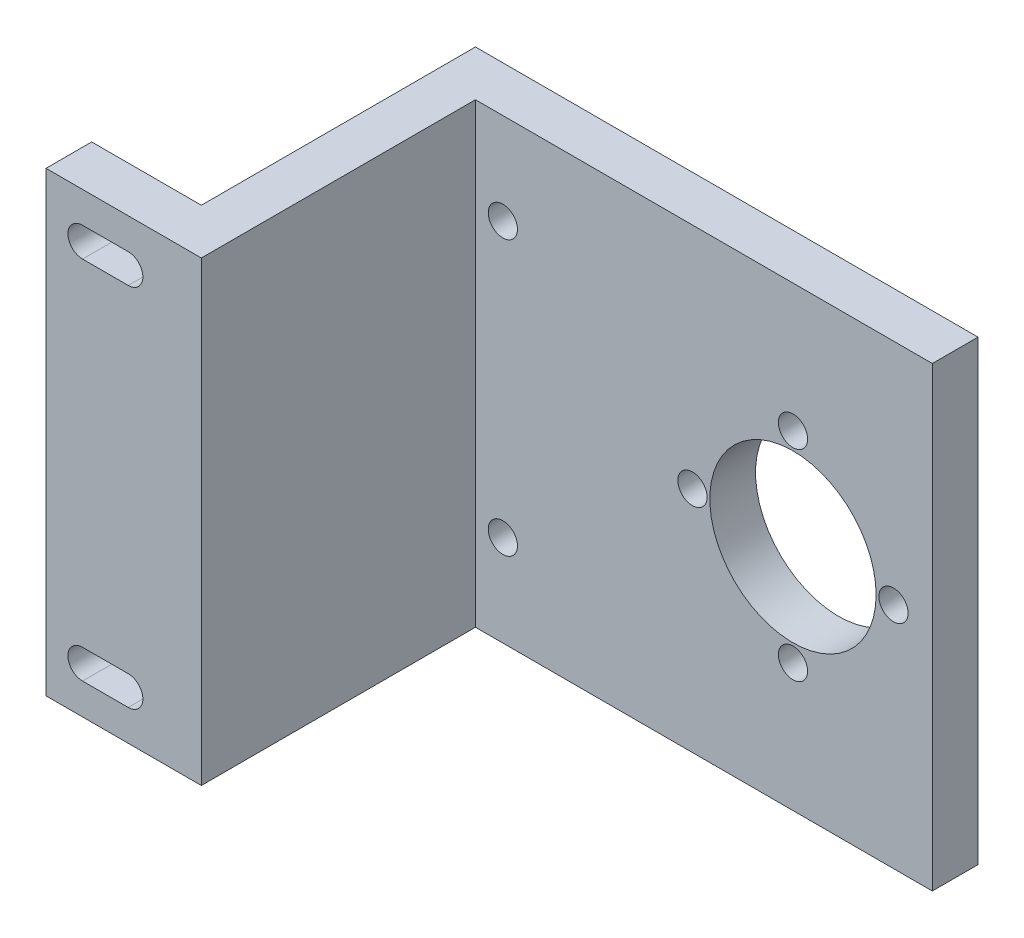
from build123d import *

# Parameters (mm, degrees)
SKETCH1_W           = 55
SKETCH1_H           = 5
BOSS_EXTRUDE1_DEPTH = 50
SKETCH2_R           = 9.1
SKETCH2_R_2         = 1.6
CUT_EXTRUDE1_DEPTH  = 75.498322129
SKETCH3_W           = 5
SKETCH3_H           = 50
BOSS_EXTRUDE2_DEPTH = 30
SKETCH4_W           = 17
SKETCH4_H           = 50
BOSS_EXTRUDE3_DEPTH = 5


with BuildPart() as part:
    # Sketch1 → Boss-Extrude1 (new body)
    with BuildSketch(Plane(origin=(0, 0, 0), x_dir=(1, 0, 0), z_dir=(0, 1, 0))):
        with Locations((27.5, 2.5)):
            Rectangle(SKETCH1_W, SKETCH1_H)
    extrude(amount=BOSS_EXTRUDE1_DEPTH)

    # Sketch2 → Cut-Extrude1 (cut, through all)
    with BuildSketch(Plane.XY):
        with Locations((39.75, 25)):
            Circle(SKETCH2_R)
        with Locations((39.75, 36)):
            Circle(SKETCH2_R_2)
        with Locations((50.75, 25)):
            Circle(SKETCH2_R_2)
        with Locations((39.75, 14)):
            Circle(SKETCH2_R_2)
        with Locations((28.75, 25)):
            Circle(SKETCH2_R_2)
        with Locations((8, 40)):
            Circle(SKETCH2_R_2)
        with Locations((8, 10)):
            Circle(SKETCH2_R_2)
    extrude(amount=-CUT_EXTRUDE1_DEPTH, mode=Mode.SUBTRACT)

    # Sketch3 → Boss-Extrude2 (add)
    with BuildSketch(Plane.XY):
        with Locations((2.5, 25)):
            Rectangle(SKETCH3_W, SKETCH3_H)
    extrude(amount=BOSS_EXTRUDE2_DEPTH)

    # Sketch4 → Boss-Extrude3 (add)
    with BuildSketch(Plane.XY.offset(30)):
        with Locations((-3.5, 25)):
            Rectangle(SKETCH4_W, SKETCH4_H)
        with BuildLine():
            Line((-8, 46.6), (-3, 46.6))
            ThreePointArc((-3, 46.6), (-1.4, 45), (-3, 43.4))
            Line((-3, 43.4), (-8, 43.4))
            ThreePointArc((-8, 43.4), (-9.6, 45), (-8, 46.6))
        make_face(mode=Mode.SUBTRACT)
        with BuildLine():
            Line((-8, 3.4), (-3, 3.4))
            ThreePointArc((-3, 3.4), (-1.4, 5), (-3, 6.6))
            Line((-3, 6.6), (-8, 6.6))
            ThreePointArc((-8, 6.6), (-9.6, 5), (-8, 3.4))
        make_face(mode=Mode.SUBTRACT)
    extrude(amount=-BOSS_EXTRUDE3_DEPTH)


solid = part.part
